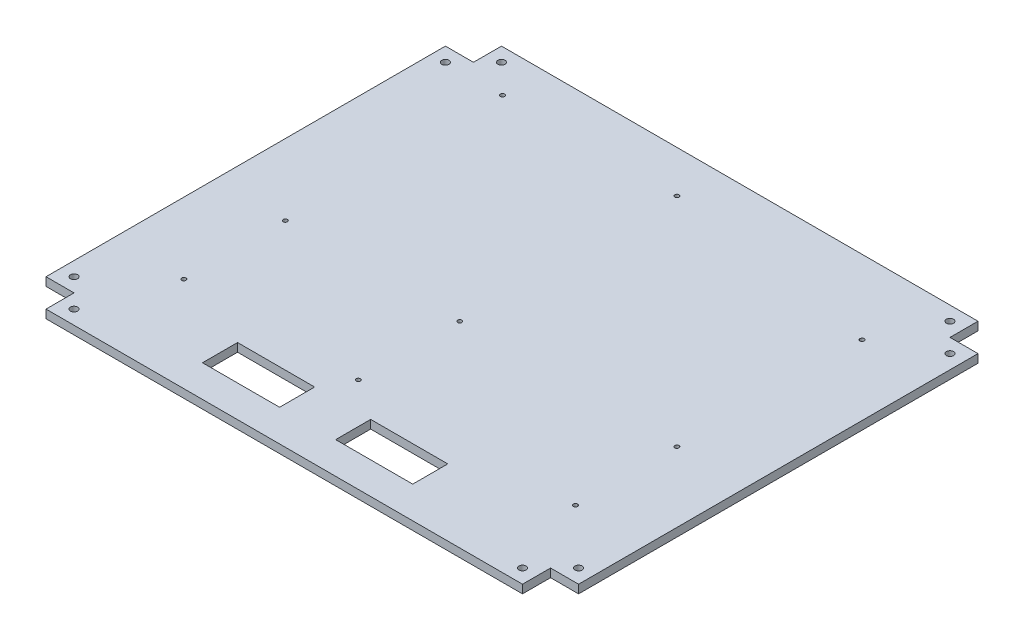
from build123d import *

# Parameters (mm, degrees)
BASE_PLATE_W        = 380
BASE_PLATE_H        = 325
BASE_PLATE_R        = 1.5
BASE_PLATE_R_2      = 2.5
BASE_PLATE_W_2      = 55
BASE_PLATE_H_2      = 25
BOSS_EXTRUDE1_DEPTH = 6
SKETCH1_W           = 20
SKETCH1_H           = 20
CUT_EXTRUDE1_DEPTH  = 10
SKETCH2_R           = 2.55
CUT_EXTRUDE2_DEPTH  = 10


with BuildPart() as part:
    # Base Plate → Boss-Extrude1 (new body)
    with BuildSketch(Plane(origin=(0, 0, 0), x_dir=(1, 0, 0), z_dir=(0, 1, 0))):
        Rectangle(BASE_PLATE_W, BASE_PLATE_H)
        with Locations(Location((-139.29, -94.83, 0), (0, 0, 270))):
            Circle(BASE_PLATE_R, mode=Mode.SUBTRACT)
        with Locations(Location((-14.83, -22.44, 0), (0, 0, 270))):
            Circle(BASE_PLATE_R, mode=Mode.SUBTRACT)
        with Locations(Location((-139.29, -22.44, 0), (0, 0, 270))):
            Circle(BASE_PLATE_R, mode=Mode.SUBTRACT)
        with Locations(Location((-139.29, 132.5, 0), (0, 0, 270))):
            Circle(BASE_PLATE_R, mode=Mode.SUBTRACT)
        with Locations(Location((-14.83, 132.5, 0), (0, 0, 270))):
            Circle(BASE_PLATE_R, mode=Mode.SUBTRACT)
        with Locations(Location((-14.83, -94.83, 0), (0, 0, 270))):
            Circle(BASE_PLATE_R, mode=Mode.SUBTRACT)
        with Locations(Location((140.11, -94.83, 0), (0, 0, 270))):
            Circle(BASE_PLATE_R, mode=Mode.SUBTRACT)
        with Locations(Location((140.11, -22.44, 0), (0, 0, 270))):
            Circle(BASE_PLATE_R, mode=Mode.SUBTRACT)
        with Locations(Location((140.11, 109.64, 0), (0, 0, 270))):
            Circle(BASE_PLATE_R, mode=Mode.SUBTRACT)
        with Locations(Location((-180, -152.5, 0), (0, 0, 270))):
            Circle(BASE_PLATE_R_2, mode=Mode.SUBTRACT)
        with Locations(Location((180, -152.5, 0), (0, 0, 270))):
            Circle(BASE_PLATE_R_2, mode=Mode.SUBTRACT)
        with Locations(Location((-180, 152.5, 0), (0, 0, 270))):
            Circle(BASE_PLATE_R_2, mode=Mode.SUBTRACT)
        with Locations(Location((180, 152.5, 0), (0, 0, 270))):
            Circle(BASE_PLATE_R_2, mode=Mode.SUBTRACT)
        with Locations((41.5, -127.33)):
            Rectangle(BASE_PLATE_W_2, BASE_PLATE_H_2, mode=Mode.SUBTRACT)
        with Locations((-53.5, -127.33)):
            Rectangle(BASE_PLATE_W_2, BASE_PLATE_H_2, mode=Mode.SUBTRACT)
    extrude(amount=BOSS_EXTRUDE1_DEPTH)

    # Sketch1 → Cut-Extrude1 (cut)
    with BuildSketch(Plane(origin=(0, 6, 0), x_dir=(1, 0, 0), z_dir=(0, 1, 0))):
        with Locations((-180, 152.5)):
            Rectangle(SKETCH1_W, SKETCH1_H)
        with Locations((180, 152.5)):
            Rectangle(SKETCH1_W, SKETCH1_H)
        with Locations((180, -152.5)):
            Rectangle(SKETCH1_W, SKETCH1_H)
        with Locations((-180, -152.5)):
            Rectangle(SKETCH1_W, SKETCH1_H)
    extrude(amount=-CUT_EXTRUDE1_DEPTH, mode=Mode.SUBTRACT)

    # Sketch2 → Cut-Extrude2 (cut)
    with BuildSketch(Plane.XZ):
        with Locations(Location((-160, 152.5, 0), (0, 0, 270))):
            Circle(SKETCH2_R)
        with Locations(Location((-180, 132.5, 0), (0, 0, 270))):
            Circle(SKETCH2_R)
        with Locations(Location((-180, -132.5, 0), (0, 0, 270))):
            Circle(SKETCH2_R)
        with Locations(Location((-160, -152.5, 0), (0, 0, 270))):
            Circle(SKETCH2_R)
        with Locations(Location((160, -152.5, 0), (0, 0, 270))):
            Circle(SKETCH2_R)
        with Locations(Location((180, -132.5, 0), (0, 0, 270))):
            Circle(SKETCH2_R)
        with Locations(Location((180, 132.5, 0), (0, 0, 270))):
            Circle(SKETCH2_R)
        with Locations(Location((160, 152.5, 0), (0, 0, 270))):
            Circle(SKETCH2_R)
    extrude(amount=-CUT_EXTRUDE2_DEPTH, mode=Mode.SUBTRACT)


solid = part.part
